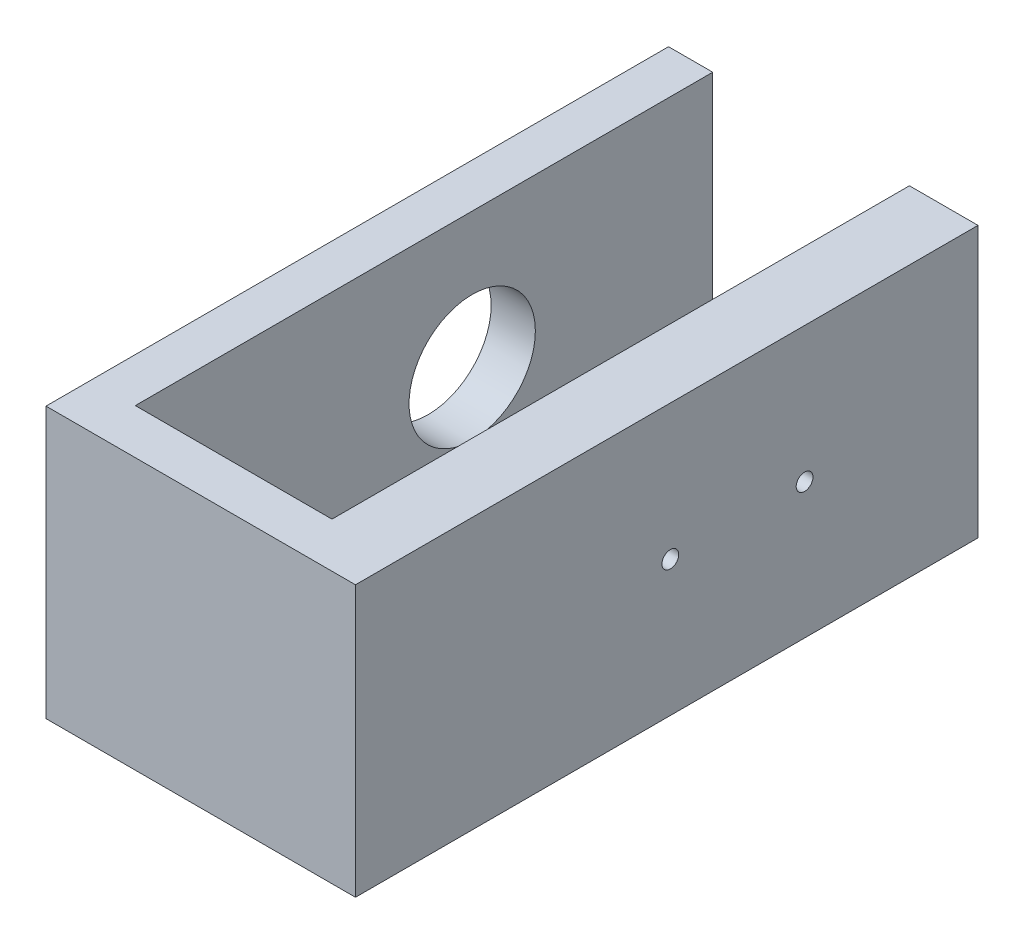
from build123d import *

# Parameters (mm, degrees)
BOSS_EXTRUDE1_DEPTH = 30
SKETCH2_R           = 7
CUT_EXTRUDE1_DEPTH  = 70
SKETCH3_W           = 111.167782235
SKETCH3_H           = 40.74685258
CUT_EXTRUDE2_DEPTH  = 0.8
SKETCH5_W           = 117.774687649
SKETCH5_H           = 158.291815666
CUT_EXTRUDE3_DEPTH  = 0.8
SKETCH6_W           = 70
SKETCH6_H           = 30
BOSS_EXTRUDE2_DEPTH = 3.4
SKETCH7_W           = 70
SKETCH7_H           = 30
BOSS_EXTRUDE3_DEPTH = 6.7
SKETCH8_W           = 83.763231722
SKETCH8_H           = 77.916949986
CUT_EXTRUDE5_DEPTH  = 6
SKETCH9_R           = 7
CUT_EXTRUDE6_DEPTH  = 90.354574589
SKETCH10_W          = 29.9
SKETCH10_H          = 30
BOSS_EXTRUDE4_DEPTH = 6
SKETCH11_W          = 55.967068903
SKETCH11_H          = 62.229878259
CUT_EXTRUDE7_DEPTH  = 6
SKETCH12_W          = 64
SKETCH12_H          = 30
BOSS_EXTRUDE6_DEPTH = 4.05
SKETCH13_W          = 85.617860434
SKETCH13_H          = 123.38327663
CUT_EXTRUDE9_DEPTH  = 4.05
SKETCH15_W          = 39.049263631
SKETCH15_H          = 151.632152685
CUT_EXTRUDE10_DEPTH = 3.95
SKETCH16_W          = 64
SKETCH16_H          = 30
BOSS_EXTRUDE7_DEPTH = 4.05
SKETCH17_W          = 96.474130843
SKETCH17_H          = 104.566259817
CUT_EXTRUDE11_DEPTH = 4.05
SKETCH18_W          = 6.755230809
SKETCH18_H          = 55.059186595
CUT_EXTRUDE12_DEPTH = 4.05
SKETCH19_R          = 7
CUT_EXTRUDE14_DEPTH = 34.05
SKETCH23_W          = 19.849593964
SKETCH23_H          = 19.85515092
BOSS_EXTRUDE9_DEPTH = 4.2
SKETCH24_R          = 0.93
CUT_EXTRUDE16_DEPTH = 4
SKETCH24_5_R        = 0.93
CUT_EXTRUDE17_DEPTH = 4
SKETCH26_R          = 7
CUT_EXTRUDE18_DEPTH = 0.4


with BuildPart() as part:
    # Sketch1 → Boss-Extrude1 (new body)
    with BuildSketch(Plane(origin=(0, 0, 0), x_dir=(1, 0, 0), z_dir=(0, 1, 0))):
        Polygon((0, 0), (50, 0), (50, 75), (45, 75), (45, 5), (5, 5), (5, 75), (0, 75), align=None)
    extrude(amount=BOSS_EXTRUDE1_DEPTH)

    # Sketch2 → Cut-Extrude1 (cut)
    with BuildSketch(Plane(origin=(50, 0, 0), x_dir=(0, 0, -1), z_dir=(1, 0, 0))):
        with Locations((48.34, 15)):
            Circle(SKETCH2_R)
    extrude(amount=-CUT_EXTRUDE1_DEPTH, mode=Mode.SUBTRACT)

    # Sketch3 → Cut-Extrude2 (cut)
    with BuildSketch(Plane(origin=(50, 0, 0), x_dir=(0, 0, -1), z_dir=(1, 0, 0))):
        with Locations((37.634857553, 15.397923555)):
            Rectangle(SKETCH3_W, SKETCH3_H)
    extrude(amount=-CUT_EXTRUDE2_DEPTH, mode=Mode.SUBTRACT)

    # Sketch5 → Cut-Extrude3 (cut)
    with BuildSketch(Plane.ZY):
        with Locations((-53.14418593, -0.770080807)):
            Rectangle(SKETCH5_W, SKETCH5_H)
    extrude(amount=-CUT_EXTRUDE3_DEPTH, mode=Mode.SUBTRACT)

    # Sketch6 → Boss-Extrude2 (add)
    with BuildSketch(Plane.ZY.offset(-45)):
        with Locations((-40, 15)):
            Rectangle(SKETCH6_W, SKETCH6_H)
    extrude(amount=BOSS_EXTRUDE2_DEPTH)

    # Sketch7 → Boss-Extrude3 (add)
    with BuildSketch(Plane(origin=(5, 0, 0), x_dir=(0, 0, -1), z_dir=(1, 0, 0))):
        with Locations((40, 15)):
            Rectangle(SKETCH7_W, SKETCH7_H)
    extrude(amount=BOSS_EXTRUDE3_DEPTH)

    # Sketch8 → Cut-Extrude5 (cut)
    with BuildSketch(Plane.ZY.offset(-0.8)):
        with Locations((-33.178908474, 22.347774268)):
            Rectangle(SKETCH8_W, SKETCH8_H)
    extrude(amount=-CUT_EXTRUDE5_DEPTH, mode=Mode.SUBTRACT)

    # Sketch9 → Cut-Extrude6 (cut, through all)
    with BuildSketch(Plane(origin=(45, 0, 0), x_dir=(0, 0, -1), z_dir=(1, 0, 0))):
        with Locations((48.34, 15)):
            Circle(SKETCH9_R)
    extrude(amount=-CUT_EXTRUDE6_DEPTH, mode=Mode.SUBTRACT)

    # Sketch10 → Boss-Extrude4 (add)
    with BuildSketch(Plane(origin=(0, 0, -5), x_dir=(-1, 0, 0), z_dir=(0, 0, -1))):
        with Locations((-26.65, 15)):
            Rectangle(SKETCH10_W, SKETCH10_H)
    extrude(amount=BOSS_EXTRUDE4_DEPTH)

    # Sketch11 → Cut-Extrude7 (cut)
    with BuildSketch(Plane.XY):
        with Locations((27.983534452, 15.70224338)):
            Rectangle(SKETCH11_W, SKETCH11_H)
    extrude(amount=-CUT_EXTRUDE7_DEPTH, mode=Mode.SUBTRACT)

    # Sketch12 → Boss-Extrude6 (add)
    with BuildSketch(Plane(origin=(11.7, 0, 0), x_dir=(0, 0, -1), z_dir=(1, 0, 0))):
        with Locations((43, 15)):
            Rectangle(SKETCH12_W, SKETCH12_H)
    extrude(amount=BOSS_EXTRUDE6_DEPTH)

    # Sketch13 → Cut-Extrude9 (cut)
    with BuildSketch(Plane.ZY.offset(-6.8)):
        with Locations((-48.94815067, 16.542324461)):
            Rectangle(SKETCH13_W, SKETCH13_H)
    extrude(amount=-CUT_EXTRUDE9_DEPTH, mode=Mode.SUBTRACT)

    # Sketch15 → Cut-Extrude10 (cut)
    with BuildSketch(Plane.ZY.offset(-6.8)):
        with Locations((0.466031991, 2.740241295)):
            Rectangle(SKETCH15_W, SKETCH15_H)
    extrude(amount=-CUT_EXTRUDE10_DEPTH, mode=Mode.SUBTRACT)

    # Sketch16 → Boss-Extrude7 (add)
    with BuildSketch(Plane(origin=(15.75, 0, 0), x_dir=(0, 0, -1), z_dir=(1, 0, 0))):
        with Locations((43, 15)):
            Rectangle(SKETCH16_W, SKETCH16_H)
    extrude(amount=BOSS_EXTRUDE7_DEPTH)

    # Sketch17 → Cut-Extrude11 (cut)
    with BuildSketch(Plane.ZY.offset(-10.85)):
        with Locations((-42.673680758, 11.569509922)):
            Rectangle(SKETCH17_W, SKETCH17_H)
    extrude(amount=-CUT_EXTRUDE11_DEPTH, mode=Mode.SUBTRACT)


with BuildPart() as cut_extrude11_piece_1:
    # of the separate pieces the step leaves, piece 1, a body of its own (cut_extrude11_pieces)
    add(part.part.solids().sort_by_distance((14.9, 0, -75))[0])

    # Sketch19 → Cut-Extrude14 (cut)
    with BuildSketch(Plane(origin=(19.8, 0, 0), x_dir=(0, 0, -1), z_dir=(1, 0, 0))):
        with Locations((48.34, 15)):
            Circle(SKETCH19_R)
    extrude(amount=-CUT_EXTRUDE14_DEPTH, mode=Mode.SUBTRACT)

    # Sketch23 → Boss-Extrude9 (add)
    with BuildSketch(Plane(origin=(49.2, 0, 0), x_dir=(0, 0, -1), z_dir=(1, 0, 0))):
        with Locations((46.616592264, 15.948021262)):
            Rectangle(SKETCH23_W, SKETCH23_H)
    extrude(amount=-BOSS_EXTRUDE9_DEPTH)

    # Sketch24 → Cut-Extrude16 (cut)
    with BuildSketch(Plane(origin=(49.2, 0, 0), x_dir=(0, 0, -1), z_dir=(1, 0, 0))):
        with Locations((55.78, 15)):
            Circle(SKETCH24_R)
    extrude(amount=-CUT_EXTRUDE16_DEPTH, mode=Mode.SUBTRACT)

    # Sketch24<5> → Cut-Extrude17 (cut)
    with BuildSketch(Plane(origin=(49.2, 0, 0), x_dir=(0, 0, -1), z_dir=(1, 0, 0))):
        with Locations((40.9, 15)):
            Circle(SKETCH24_5_R)
    extrude(amount=-CUT_EXTRUDE17_DEPTH, mode=Mode.SUBTRACT)

    # Sketch26 → Cut-Extrude18 (cut)
    with BuildSketch(Plane.ZY.offset(-45)):
        with Locations((-48.34, 15)):
            Circle(SKETCH26_R)
    extrude(amount=-CUT_EXTRUDE18_DEPTH, mode=Mode.SUBTRACT)


with BuildPart() as cut_extrude11_piece_2:
    # of the separate pieces the step leaves, piece 2, a body of its own (cut_extrude11_pieces)
    add(part.part.solids().sort_by_distance((10.85, 0, -6))[0])

    # Sketch18 → Cut-Extrude12 (cut)
    with BuildSketch(Plane.ZY.offset(-10.75)):
        with Locations((-5.990573003, 11.129995274)):
            Rectangle(SKETCH18_W, SKETCH18_H)
    extrude(amount=-CUT_EXTRUDE12_DEPTH, mode=Mode.SUBTRACT)


solid = cut_extrude11_piece_1.part
